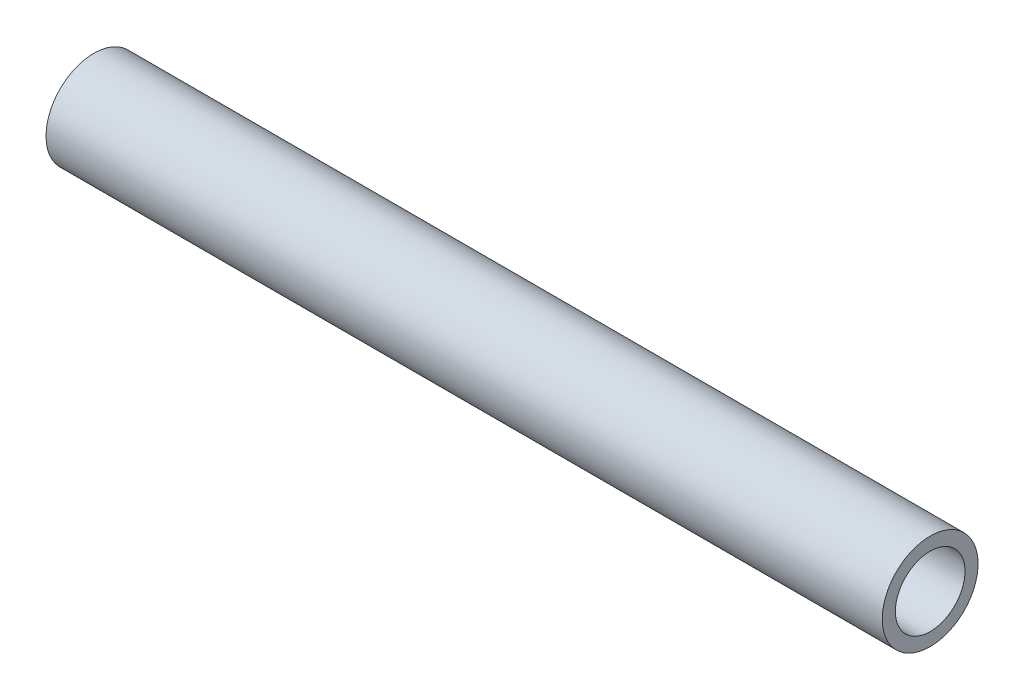
from build123d import *

# Parameters (mm, degrees)
SKETCH1_R      = 17.4625
SKETCH1_R_2    = 12.7
EXTRUDE1_DEPTH = 152.4


with BuildPart() as part:
    # Sketch1 → Extrude1 (new, symmetric)
    with BuildSketch(Plane(origin=(0, 0, 0), x_dir=(0, 0, -1), z_dir=(1, 0, 0))):
        with Locations(Location((0, 0, 0), (0, 0, 180))):
            Circle(SKETCH1_R)
        with Locations(Location((0, 0, 0), (0, 0, 180))):
            Circle(SKETCH1_R_2, mode=Mode.SUBTRACT)
    extrude(amount=EXTRUDE1_DEPTH, both=True)


solid = part.part
